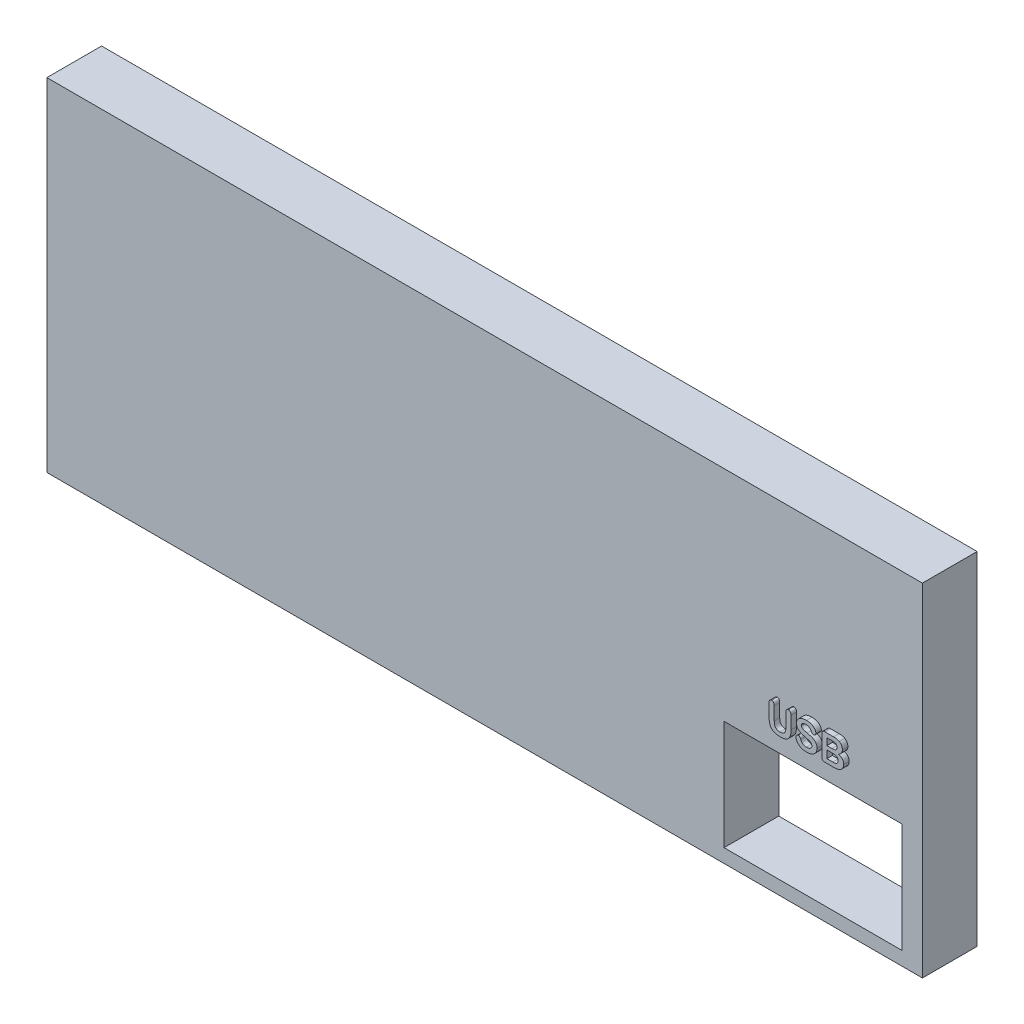
from build123d import *

# Parameters (mm, degrees)
SKETCH1_W           = 64
SKETCH1_H           = 25
BOSS_EXTRUDE1_DEPTH = 4
SKETCH2_W           = 40
SKETCH2_H           = 1
BOSS_EXTRUDE2_DEPTH = 1.5
SKETCH3_W           = 40
SKETCH3_H           = 1
BOSS_EXTRUDE3_DEPTH = 1.5
SKETCH4_W           = 13
SKETCH4_H           = 8.0000094
CUT_EXTRUDE2_DEPTH  = 5.27
BOSS_EXTRUDE5_DEPTH = 0.4


with BuildPart() as part:
    # Sketch1 → Boss-Extrude1 (new body)
    with BuildSketch(Plane.XY):
        with Locations((6.416243655, 2.220812183)):
            Rectangle(SKETCH1_W, SKETCH1_H)
    extrude(amount=BOSS_EXTRUDE1_DEPTH)

    # Sketch2 → Boss-Extrude2 (add)
    with BuildSketch(Plane(origin=(0, 0, 0), x_dir=(-1, 0, 0), z_dir=(0, 0, -1))):
        with Locations((1.583756345, -7.279192817)):
            Rectangle(SKETCH2_W, SKETCH2_H)
    extrude(amount=BOSS_EXTRUDE2_DEPTH)

    # Sketch3 → Boss-Extrude3 (add)
    with BuildSketch(Plane(origin=(0, 0, 0), x_dir=(-1, 0, 0), z_dir=(0, 0, -1))):
        with Locations((1.583756345, -4.279192817)):
            Rectangle(SKETCH3_W, SKETCH3_H)
    extrude(amount=BOSS_EXTRUDE3_DEPTH)

    # Sketch4 → Cut-Extrude2 (cut)
    with BuildSketch(Plane.XY.offset(4)):
        with Locations((30.416243607, -5.279185117)):
            Rectangle(SKETCH4_W, SKETCH4_H)
    extrude(amount=-CUT_EXTRUDE2_DEPTH, mode=Mode.SUBTRACT)

    # Sketch7 → Boss-Extrude5 (add)
    # profile 1 of 3: a face of its own
    with BuildSketch(Plane.XY.offset(4)):
        with BuildLine():
            Line((27.610484396, 1.023759885), (27.610484396, 1.95383801))
            add(Edge.make_bspline(
                [(27.610484396, 1.95383801), (27.61094523, 1.972513796), (27.611809919, 2.007556227), (27.621745355, 2.056457537), (27.637293046, 2.098297902), (27.66016154, 2.132408694), (27.688078487, 2.159053764), (27.720723649, 2.177714437), (27.757054318, 2.189733038), (27.78278238, 2.190792454), (27.796031271, 2.19133801)],
                knots=[0, 0, 0, 0, 1.314006093, 2.465543923, 3.499702682, 4.438645347, 5.334276599, 6.193453487, 7.069703068, 8, 8, 8, 8], degree=3))
            add(Edge.make_bspline(
                [(27.796031271, 2.19133801), (27.809908627, 2.190592789), (27.836569911, 2.189161063), (27.874503998, 2.178001755), (27.907642311, 2.158789299), (27.935950074, 2.131998723), (27.958547381, 2.097558698), (27.974374326, 2.05546074), (27.984070749, 2.006229869), (27.984995252, 1.970944546), (27.985484396, 1.95227551)],
                knots=[0, 0, 0, 0, 0.96282878, 1.849794185, 2.716851436, 3.599658085, 4.532680285, 5.552030856, 6.704809248, 8, 8, 8, 8], degree=3))
            Line((27.985484396, 1.95227551), (27.985484396, 0.994853635))
            add(Edge.make_bspline(
                [(27.985484396, 0.994853635), (27.985928132, 0.968667502), (27.986777425, 0.918548272), (27.993343454, 0.846582342), (28.004436254, 0.781329557), (28.020096873, 0.722386396), (28.042022447, 0.669732636), (28.071171699, 0.623360865), (28.107714858, 0.583363587), (28.143728675, 0.555398746), (28.176156321, 0.536895164), (28.203131959, 0.524740266), (28.232295444, 0.514067716), (28.264069434, 0.506237396), (28.29778462, 0.499361051), (28.333966409, 0.494951534), (28.372398762, 0.491537154), (28.398887335, 0.491405406), (28.412437521, 0.49133801)],
                knots=[0, 0, 0, 0, 1.640841622, 3.140506311, 4.523579023, 5.784571649, 6.954579444, 8.084197464, 9.198982671, 10.333306227, 10.925380769, 11.535182691, 12.185613052, 12.868404783, 13.583722754, 14.340779317, 15.151228418, 16, 16, 16, 16], degree=3))
            add(Edge.make_bspline(
                [(28.412437521, 0.49133801), (28.431077079, 0.491668285), (28.467022542, 0.492305204), (28.518718255, 0.498405435), (28.566360003, 0.507320506), (28.609493911, 0.521176222), (28.648682619, 0.538326273), (28.683575367, 0.559367911), (28.714323666, 0.58439311), (28.740689301, 0.613582343), (28.76294015, 0.647029842), (28.782626402, 0.683856839), (28.798852427, 0.724830461), (28.812582903, 0.76946839), (28.823046365, 0.818221854), (28.830297825, 0.870841321), (28.834568118, 0.927465352), (28.835171825, 0.966460643), (28.835484396, 0.98665051)],
                knots=[0, 0, 0, 0, 1.187087794, 2.289239917, 3.312641325, 4.270309596, 5.169103343, 6.032749862, 6.858132282, 7.686303516, 8.528484611, 9.411791075, 10.342302716, 11.33164497, 12.384483705, 13.515514569, 14.713654137, 16, 16, 16, 16], degree=3))
            Line((28.835484396, 0.98665051), (28.835484396, 1.95227551))
            add(Edge.make_bspline(
                [(28.835484396, 1.95227551), (28.836010283, 1.97119644), (28.8369971, 2.006701219), (28.846094331, 2.056284428), (28.861994751, 2.098178632), (28.884350309, 2.132359639), (28.911996916, 2.159293052), (28.944884511, 2.177594967), (28.981509581, 2.189837062), (29.007513822, 2.190824647), (29.021031271, 2.19133801)],
                knots=[0, 0, 0, 0, 1.324209478, 2.484855026, 3.512713035, 4.440887327, 5.324452051, 6.186293477, 7.057204391, 8, 8, 8, 8], degree=3))
            add(Edge.make_bspline(
                [(29.021031271, 2.19133801), (29.034538733, 2.190791982), (29.060772959, 2.189731485), (29.097865864, 2.177720799), (29.131134202, 2.159190427), (29.159707588, 2.132713238), (29.183306404, 2.098843351), (29.199424976, 2.056683825), (29.209077527, 2.00727214), (29.209996558, 1.971856195), (29.210484396, 1.95305676)],
                knots=[0, 0, 0, 0, 0.937671153, 1.821147261, 2.686184232, 3.571984669, 4.510357278, 5.535961965, 6.692043289, 8, 8, 8, 8], degree=3))
            Line((29.210484396, 1.95305676), (29.210484396, 1.01946301))
            add(Edge.make_bspline(
                [(29.210484396, 1.01946301), (29.209958418, 0.983122147), (29.208948503, 0.913345177), (29.201377484, 0.813367212), (29.188139322, 0.722793953), (29.170246464, 0.640498848), (29.144287357, 0.565027598), (29.108590229, 0.495194134), (29.063726156, 0.429791859), (29.027052362, 0.39126413), (29.008531271, 0.37180676)],
                knots=[0, 0, 0, 0, 1.248457049, 2.397123805, 3.441600438, 4.391152342, 5.286682789, 6.174943873, 7.078305605, 8, 8, 8, 8], degree=3))
            add(Edge.make_bspline(
                [(29.008531271, 0.37180676), (28.990757669, 0.356791201), (28.955252069, 0.32679523), (28.896086129, 0.289522304), (28.833121402, 0.257856632), (28.765491799, 0.232859141), (28.692806372, 0.21414824), (28.614638364, 0.201153438), (28.530718615, 0.192765671), (28.472745062, 0.191823132), (28.442906271, 0.19133801)],
                knots=[0, 0, 0, 0, 0.917673777, 1.83319953, 2.752815171, 3.696261941, 4.673826777, 5.7116717, 6.822205161, 8, 8, 8, 8], degree=3))
            add(Edge.make_bspline(
                [(28.442906271, 0.19133801), (28.407467987, 0.191916181), (28.33907496, 0.193032005), (28.240287217, 0.202156539), (28.1490205, 0.216541524), (28.065330804, 0.237654892), (27.988780973, 0.264616196), (27.92014467, 0.299466461), (27.857883514, 0.339543132), (27.803544183, 0.38742923), (27.756180605, 0.441969916), (27.715500086, 0.503462674), (27.68267007, 0.572465125), (27.65530156, 0.648135936), (27.635668464, 0.731458493), (27.620655217, 0.821996335), (27.612354772, 0.920351154), (27.611122892, 0.988458915), (27.610484396, 1.023759885)],
                knots=[0, 0, 0, 0, 1.244583114, 2.401944964, 3.48169555, 4.486712429, 5.430003149, 6.325898902, 7.184706889, 8.024138875, 8.860562605, 9.715550095, 10.605366032, 11.538500779, 12.536866304, 13.60758979, 14.759988597, 16, 16, 16, 16], degree=3))
        make_face()
    # profile 2 of 3: a face of its own
    with BuildSketch(Plane.XY.offset(4)):
        with BuildLine():
            add(Edge.make_bspline(
                [(31.110484396, 0.815166135), (31.110162636, 0.800442149), (31.109526292, 0.771322608), (31.105111891, 0.728255855), (31.098092466, 0.686367448), (31.088424505, 0.645563154), (31.0754168, 0.606056159), (31.059638968, 0.567612005), (31.041519867, 0.5300475), (31.019725162, 0.494096934), (30.995824224, 0.459454969), (30.968889631, 0.426815446), (30.939778852, 0.395855435), (30.907356322, 0.367319062), (30.872682686, 0.340399629), (30.835402427, 0.315268005), (30.795432953, 0.292236766), (30.752931018, 0.271162788), (30.708004016, 0.252482973), (30.66102891, 0.236151809), (30.61212416, 0.221741803), (30.560920255, 0.211371384), (30.507982454, 0.201953346), (30.452776152, 0.196029901), (30.395574625, 0.19187556), (30.356716331, 0.191518665), (30.337046896, 0.19133801)],
                knots=[0, 0, 0, 0, 0.94904565, 1.876922008, 2.787632434, 3.685409961, 4.577243309, 5.465673456, 6.362823001, 7.262481841, 8.172882791, 9.073480814, 9.987781212, 10.909257821, 11.854472834, 12.815908446, 13.804938933, 14.825933836, 15.871877953, 16.938992789, 18.030809531, 19.155177508, 20.304610591, 21.495671913, 22.732349945, 24, 24, 24, 24], degree=3))
            add(Edge.make_bspline(
                [(30.337046896, 0.19133801), (30.313602923, 0.191779573), (30.267571872, 0.192646559), (30.200089971, 0.197477133), (30.135850476, 0.206707315), (30.074557119, 0.218563771), (30.016441411, 0.234514022), (29.96161887, 0.254278107), (29.909530313, 0.276534676), (29.877249919, 0.295056961), (29.861265646, 0.304228635)],
                knots=[0, 0, 0, 0, 1.136969792, 2.232382444, 3.278022597, 4.282276305, 5.258039159, 6.196692155, 7.1070566, 8, 8, 8, 8], degree=3))
            add(Edge.make_bspline(
                [(29.861265646, 0.304228635), (29.840549639, 0.317891255), (29.799330646, 0.345076003), (29.744641445, 0.395342206), (29.694874269, 0.45084335), (29.652659524, 0.512365261), (29.61808184, 0.576396703), (29.592636925, 0.640811354), (29.576966157, 0.704654875), (29.574817393, 0.747116824), (29.573765646, 0.76790051)],
                knots=[0, 0, 0, 0, 1.048405233, 2.086029851, 3.131870059, 4.19698972, 5.234628962, 6.204463721, 7.121145791, 8, 8, 8, 8], degree=3))
            add(Edge.make_bspline(
                [(29.573765646, 0.76790051), (29.574359615, 0.779550042), (29.575519673, 0.802302307), (29.584829868, 0.834981398), (29.600070588, 0.864843451), (29.620573383, 0.891768383), (29.64626646, 0.913982442), (29.675776047, 0.930308046), (29.708640829, 0.940619369), (29.7317605, 0.94160882), (29.743687521, 0.94211926)],
                knots=[0, 0, 0, 0, 1.029346977, 2.010378973, 2.978887221, 3.98112847, 4.985683985, 5.960201932, 6.947705008, 8, 8, 8, 8], degree=3))
            add(Edge.make_bspline(
                [(29.743687521, 0.94211926), (29.753378325, 0.941742916), (29.772159384, 0.941013548), (29.799120823, 0.933155726), (29.823648749, 0.920524081), (29.845843694, 0.902717993), (29.866316271, 0.88065243), (29.884617559, 0.853434486), (29.901925174, 0.821900046), (29.911139245, 0.79849032), (29.915953146, 0.786259885)],
                knots=[0, 0, 0, 0, 0.932433643, 1.807083439, 2.683354794, 3.577798377, 4.537574086, 5.575745438, 6.73344572, 8, 8, 8, 8], degree=3))
            add(Edge.make_bspline(
                [(29.915953146, 0.786259885), (29.922351811, 0.77149794), (29.934702099, 0.743005389), (29.954433256, 0.702450455), (29.97584207, 0.666246905), (29.997096247, 0.632623734), (30.02179405, 0.602475252), (30.051151746, 0.575953191), (30.084560078, 0.551544027), (30.122737756, 0.529851174), (30.166409302, 0.511932398), (30.216530158, 0.500437885), (30.27232521, 0.49225425), (30.311751853, 0.491652522), (30.332359396, 0.49133801)],
                knots=[0, 0, 0, 0, 1.049400523, 2.025484958, 2.938775158, 3.791458515, 4.617854192, 5.471340711, 6.364831691, 7.311813007, 8.329001391, 9.430967745, 10.65721654, 12, 12, 12, 12], degree=3))
            add(Edge.make_bspline(
                [(30.332359396, 0.49133801), (30.346953576, 0.491514238), (30.375546147, 0.4918595), (30.417275792, 0.495984531), (30.457026663, 0.501982375), (30.494372241, 0.511212176), (30.530022791, 0.521819133), (30.563172847, 0.53616575), (30.594506713, 0.552425759), (30.623389154, 0.571170621), (30.649547872, 0.591829909), (30.672652018, 0.613902839), (30.692021671, 0.637559111), (30.707688519, 0.662433922), (30.72055765, 0.688201808), (30.728885595, 0.715563179), (30.734868681, 0.743942309), (30.735276649, 0.763440394), (30.735484396, 0.77336926)],
                knots=[0, 0, 0, 0, 1.280104897, 2.507951138, 3.676307556, 4.80418709, 5.881088807, 6.935759984, 7.968101261, 8.975871649, 9.951925376, 10.889226907, 11.77430911, 12.626938706, 13.464975202, 14.292430499, 15.130466995, 16, 16, 16, 16], degree=3))
            add(Edge.make_bspline(
                [(30.735484396, 0.77336926), (30.734775183, 0.788683184), (30.733408065, 0.818203124), (30.721744121, 0.860074839), (30.702723053, 0.897528071), (30.675386802, 0.929563406), (30.642627801, 0.95760475), (30.605378773, 0.982325813), (30.563472832, 1.002928794), (30.516793714, 1.020659436), (30.463778387, 1.036328086), (30.403748169, 1.053394729), (30.335328321, 1.069787127), (30.287056357, 1.080836482), (30.261656271, 1.08665051)],
                knots=[0, 0, 0, 0, 0.889216893, 1.714102054, 2.506617733, 3.313297162, 4.145346194, 5.008548814, 5.905982136, 6.85524107, 7.90915739, 9.119934543, 10.484546625, 12, 12, 12, 12], degree=3))
            add(Edge.make_bspline(
                [(30.261656271, 1.08665051), (30.228376951, 1.094824625), (30.164330639, 1.110555774), (30.073185974, 1.137880591), (29.990539588, 1.167220018), (29.915431859, 1.198031844), (29.848247401, 1.23365242), (29.788405138, 1.274892455), (29.736323915, 1.322474391), (29.698435609, 1.36664401), (29.672980848, 1.40520706), (29.655967471, 1.435770071), (29.641969183, 1.468260001), (29.63068929, 1.502424383), (29.621715443, 1.538069971), (29.614997827, 1.575373312), (29.611054171, 1.614428918), (29.610676503, 1.6410686), (29.610484396, 1.65461926)],
                knots=[0, 0, 0, 0, 1.736501148, 3.341910126, 4.819600125, 6.179978285, 7.452384316, 8.666026066, 9.852526874, 11.018500134, 11.604160195, 12.191898388, 12.788898658, 13.394048862, 14.013423104, 14.650267458, 15.313438986, 16, 16, 16, 16], degree=3))
            add(Edge.make_bspline(
                [(29.610484396, 1.65461926), (29.61062389, 1.667656362), (29.610899498, 1.693414783), (29.615686623, 1.731465992), (29.621841353, 1.768562817), (29.632054214, 1.804314391), (29.643977455, 1.839145201), (29.658815133, 1.872969526), (29.677014525, 1.905249411), (29.697171078, 1.936685374), (29.720384948, 1.966299553), (29.745835678, 1.994629396), (29.773940922, 2.021131347), (29.804477328, 2.045653514), (29.837087774, 2.068603662), (29.872480453, 2.08925834), (29.910284354, 2.108194606), (29.964223066, 2.132214605), (30.037358571, 2.156115035), (30.131273004, 2.176880786), (30.23257275, 2.188846141), (30.302510198, 2.190489677), (30.338609396, 2.19133801)],
                knots=[0, 0, 0, 0, 0.769447055, 1.520256708, 2.262508943, 2.988321943, 3.713156319, 4.436274914, 5.166110871, 5.89994773, 6.639925254, 7.385953261, 8.147635144, 8.918771606, 9.697541001, 10.500837489, 11.336648996, 12.194084557, 13.986552036, 15.869357873, 17.867910982, 20, 20, 20, 20], degree=3))
            add(Edge.make_bspline(
                [(30.338609396, 2.19133801), (30.367406719, 2.190854856), (30.423042821, 2.189921406), (30.503494669, 2.181600726), (30.577903263, 2.168217485), (30.646287079, 2.149104647), (30.708488141, 2.12477818), (30.766016732, 2.098415811), (30.817257455, 2.06680291), (30.863087506, 2.032450235), (30.90312827, 1.995954645), (30.937506762, 1.958136651), (30.96629473, 1.919528647), (30.988884575, 1.879838667), (31.006667845, 1.840345872), (31.019267022, 1.801054937), (31.027137628, 1.762097233), (31.028018511, 1.73616463), (31.028453146, 1.72336926)],
                knots=[0, 0, 0, 0, 1.501690988, 2.90125006, 4.213360721, 5.441058994, 6.597662568, 7.694391675, 8.736870916, 9.731158549, 10.678212085, 11.558107852, 12.393499291, 13.184506524, 13.935459515, 14.648542639, 15.3331793, 16, 16, 16, 16], degree=3))
            add(Edge.make_bspline(
                [(31.028453146, 1.72336926), (31.027842644, 1.71198079), (31.026637032, 1.689490948), (31.017227975, 1.656696403), (31.001701607, 1.625966164), (30.980801159, 1.597742812), (30.955561225, 1.573553), (30.926225178, 1.555902566), (30.893819186, 1.544742839), (30.870991979, 1.543524083), (30.859312521, 1.54290051)],
                knots=[0, 0, 0, 0, 0.996822281, 1.968514991, 2.963507279, 3.999520829, 5.032703306, 6.005199511, 6.979367534, 8, 8, 8, 8], degree=3))
            add(Edge.make_bspline(
                [(30.859312521, 1.54290051), (30.848997462, 1.543256077), (30.829507827, 1.543927898), (30.802202392, 1.549388498), (30.778611517, 1.558221474), (30.758431999, 1.571516284), (30.740543995, 1.589209465), (30.722781312, 1.611050352), (30.703415876, 1.636692334), (30.691439701, 1.65607012), (30.685093771, 1.66633801)],
                knots=[0, 0, 0, 0, 1.091449335, 2.062222683, 2.935356023, 3.742291246, 4.60049062, 5.589116983, 6.722522559, 8, 8, 8, 8], degree=3))
            add(Edge.make_bspline(
                [(30.685093771, 1.66633801), (30.675939776, 1.685144039), (30.658276268, 1.721432068), (30.626928634, 1.771107976), (30.59228642, 1.813804218), (30.561293931, 1.845187959), (30.533959901, 1.866786644), (30.510108327, 1.879966875), (30.483592128, 1.891102707), (30.454391008, 1.90070021), (30.422148194, 1.907494351), (30.387043348, 1.912492737), (30.349081804, 1.915636095), (30.322860363, 1.916098895), (30.309312521, 1.91633801)],
                knots=[0, 0, 0, 0, 1.547925219, 2.986869477, 4.337480217, 5.612327564, 6.244828973, 6.909713596, 7.622436063, 8.372459485, 9.181850378, 10.058552105, 10.996911345, 12, 12, 12, 12], degree=3))
            add(Edge.make_bspline(
                [(30.309312521, 1.91633801), (30.28439651, 1.915511849), (30.236847404, 1.913935223), (30.169018617, 1.902113779), (30.108910174, 1.880888727), (30.064792009, 1.856401543), (30.034005745, 1.833902779), (30.014602055, 1.815862941), (29.997717645, 1.797448019), (29.984449037, 1.777700436), (29.973824172, 1.757267778), (29.965659698, 1.736004177), (29.961529304, 1.713633038), (29.96083287, 1.698513003), (29.960484396, 1.690947385)],
                knots=[0, 0, 0, 0, 1.954508865, 3.729936959, 5.377867423, 6.932763574, 7.670377485, 8.364471239, 9.008409927, 9.626125187, 10.224705099, 10.812996495, 11.406058616, 12, 12, 12, 12], degree=3))
            add(Edge.make_bspline(
                [(29.960484396, 1.690947385), (29.96081565, 1.681666084), (29.96146749, 1.663402341), (29.967901596, 1.637116735), (29.978292159, 1.612766207), (29.992469344, 1.59028927), (30.010637001, 1.569962945), (30.032241284, 1.551743188), (30.055837146, 1.53381997), (30.0921569, 1.513541826), (30.139484496, 1.491383237), (30.190185628, 1.473791449), (30.235934982, 1.461513112), (30.279630491, 1.45034527), (30.332637465, 1.436461546), (30.37127217, 1.427197564), (30.392125021, 1.422197385)],
                knots=[0, 0, 0, 0, 0.710476229, 1.398074961, 2.059979244, 2.732930957, 3.425942516, 4.140543967, 4.897202213, 5.693324271, 7.323324828, 8.898613798, 9.799484583, 10.954336094, 12.356121149, 14, 14, 14, 14], degree=3))
            add(Edge.make_bspline(
                [(30.392125021, 1.422197385), (30.418716791, 1.415803579), (30.470736849, 1.403295718), (30.546698022, 1.38294501), (30.618796425, 1.361648717), (30.686955607, 1.33892075), (30.750913819, 1.315267122), (30.809822335, 1.288473481), (30.863934358, 1.259736446), (30.91326176, 1.228118419), (30.957364911, 1.192629231), (30.996997989, 1.153558025), (31.030636985, 1.109298372), (31.05940335, 1.060907163), (31.08295889, 1.007591768), (31.099073136, 0.948371271), (31.10895032, 0.883598888), (31.109961067, 0.838511039), (31.110484396, 0.815166135)],
                knots=[0, 0, 0, 0, 1.267502217, 2.479546844, 3.644246111, 4.751070339, 5.809111578, 6.802976886, 7.747931384, 8.64678748, 9.513844361, 10.367269951, 11.219414442, 12.082556445, 12.971635876, 13.911644553, 14.918722911, 16, 16, 16, 16], degree=3))
        make_face()
    # profile 3 of 3: a face of its own
    with BuildSketch(Plane.XY.offset(4)):
        with BuildLine():
            Line((32.283140646, 0.21633801), (31.696421896, 0.21633801))
            add(Edge.make_bspline(
                [(31.696421896, 0.21633801), (31.68612901, 0.216443116), (31.666414054, 0.216644435), (31.63793618, 0.219414355), (31.611835214, 0.224086434), (31.58789398, 0.230265413), (31.566121332, 0.238098164), (31.546508286, 0.247634444), (31.529556893, 0.259703079), (31.509234213, 0.277551159), (31.488717083, 0.306624531), (31.472276084, 0.349118709), (31.462191874, 0.399599182), (31.461079659, 0.435946997), (31.460484396, 0.45540051)],
                knots=[0, 0, 0, 0, 0.950729654, 1.821024047, 2.639907261, 3.398604693, 4.102683231, 4.775219685, 5.406000082, 6.019447712, 7.268382492, 8.644570224, 10.204158913, 12, 12, 12, 12], degree=3))
            Line((31.460484396, 0.45540051), (31.460484396, 1.90227551))
            add(Edge.make_bspline(
                [(31.460484396, 1.90227551), (31.461025924, 1.922128362), (31.462032695, 1.959037419), (31.472633699, 2.010018741), (31.489382517, 2.052636426), (31.514566933, 2.086963762), (31.54850679, 2.112270261), (31.59071355, 2.129281529), (31.640841798, 2.139693433), (31.677094183, 2.140766116), (31.696421896, 2.14133801)],
                knots=[0, 0, 0, 0, 1.222174323, 2.272182497, 3.193385757, 4.024939207, 4.86132091, 5.767718531, 6.809874283, 8, 8, 8, 8], degree=3))
            Line((31.696421896, 2.14133801), (32.318296896, 2.14133801))
            add(Edge.make_bspline(
                [(32.318296896, 2.14133801), (32.340435193, 2.141087093), (32.383302275, 2.140601235), (32.445219646, 2.137627396), (32.502571107, 2.132151604), (32.555748862, 2.124590954), (32.605384875, 2.113566655), (32.65232616, 2.099403992), (32.696246339, 2.080025601), (32.723760677, 2.064359634), (32.737437521, 2.056572385)],
                knots=[0, 0, 0, 0, 1.226361742, 2.374642816, 3.432537546, 4.416889029, 5.347867328, 6.246718495, 7.128477734, 8, 8, 8, 8], degree=3))
            add(Edge.make_bspline(
                [(32.737437521, 2.056572385), (32.748763992, 2.049470169), (32.771415859, 2.03526641), (32.80307689, 2.010553341), (32.832493801, 1.98287184), (32.860073203, 1.953106848), (32.885153113, 1.921047978), (32.907108284, 1.887110333), (32.925406959, 1.851222982), (32.941129192, 1.81408204), (32.953766578, 1.775594845), (32.962101661, 1.735747173), (32.968036753, 1.695032086), (32.968469146, 1.667401772), (32.968687521, 1.653447385)],
                knots=[0, 0, 0, 0, 0.989179716, 1.978265507, 2.967116444, 3.97665542, 4.979268596, 5.976539418, 6.963744816, 7.957282277, 8.960127083, 9.956465876, 10.967935579, 12, 12, 12, 12], degree=3))
            add(Edge.make_bspline(
                [(32.968687521, 1.653447385), (32.967821505, 1.629936678), (32.966136382, 1.584188715), (32.952015692, 1.51809593), (32.929371461, 1.456661585), (32.896866811, 1.400292145), (32.855300183, 1.348786629), (32.804038687, 1.303028903), (32.744239423, 1.261556837), (32.699601923, 1.239224248), (32.676500021, 1.227666135)],
                knots=[0, 0, 0, 0, 1.026786861, 1.997958018, 2.939919024, 3.878158348, 4.829291737, 5.820536811, 6.872030375, 8, 8, 8, 8], degree=3))
            add(Edge.make_bspline(
                [(32.676500021, 1.227666135), (32.692059895, 1.2225067), (32.72242675, 1.21243748), (32.765914298, 1.194651254), (32.806656561, 1.175712379), (32.844315355, 1.154623601), (32.878729897, 1.131379655), (32.910614504, 1.106913534), (32.939128706, 1.080248619), (32.96477895, 1.051916903), (32.98741419, 1.021864127), (33.007210015, 0.990039327), (33.023406905, 0.956250493), (33.037506351, 0.921038119), (33.047208791, 0.883537341), (33.055392865, 0.844637733), (33.05947145, 0.80379402), (33.060143069, 0.776110379), (33.060484396, 0.762041135)],
                knots=[0, 0, 0, 0, 1.203679095, 2.349115882, 3.448557464, 4.501905559, 5.515114208, 6.496455107, 7.450530545, 8.378166232, 9.30006595, 10.210385309, 11.125664208, 12.049149821, 12.991069707, 13.966334133, 14.966460368, 16, 16, 16, 16], degree=3))
            add(Edge.make_bspline(
                [(33.060484396, 0.762041135), (33.059608769, 0.736040064), (33.057879692, 0.68469645), (33.041114148, 0.609990481), (33.014890959, 0.539080263), (32.978007947, 0.473373797), (32.93287312, 0.413458563), (32.879615162, 0.361391405), (32.818812088, 0.317536263), (32.773624529, 0.296003205), (32.750718771, 0.28508801)],
                knots=[0, 0, 0, 0, 1.034007292, 2.041826266, 3.032819392, 4.03550363, 5.031030359, 6.010000582, 6.991261149, 8, 8, 8, 8], degree=3))
            add(Edge.make_bspline(
                [(32.750718771, 0.28508801), (32.735566228, 0.279004352), (32.704621356, 0.266580165), (32.655626812, 0.251839926), (32.603336521, 0.240335217), (32.547697795, 0.230803343), (32.488056518, 0.224449451), (32.423950501, 0.219890762), (32.355180819, 0.216535647), (32.307624143, 0.216405179), (32.283140646, 0.21633801)],
                knots=[0, 0, 0, 0, 0.823393962, 1.68155411, 2.577109222, 3.523060306, 4.5276929, 5.601251204, 6.765057529, 8, 8, 8, 8], degree=3))
        make_face()
        with BuildLine():
            Line((32.246812521, 1.06633801), (31.835484396, 1.06633801))
            Line((31.835484396, 1.06633801), (31.835484396, 0.51633801))
            Line((31.835484396, 0.51633801), (32.260093771, 0.51633801))
            add(Edge.make_bspline(
                [(32.260093771, 0.51633801), (32.27624435, 0.516584656), (32.307534992, 0.517062516), (32.352928156, 0.520113019), (32.395222066, 0.525463582), (32.434465152, 0.533365061), (32.470659816, 0.54297943), (32.50394157, 0.554520025), (32.533639843, 0.569132309), (32.560395341, 0.58552364), (32.58418816, 0.603938821), (32.604530561, 0.624810326), (32.62217078, 0.647726824), (32.635958952, 0.673170687), (32.647261441, 0.700609046), (32.654825667, 0.730329859), (32.659656276, 0.762143506), (32.660203783, 0.784027894), (32.660484396, 0.79524426)],
                knots=[0, 0, 0, 0, 1.397840841, 2.708221037, 3.935522691, 5.08480215, 6.170083952, 7.175292938, 8.127891873, 9.028615238, 9.887548979, 10.724312948, 11.544753106, 12.382123976, 13.221312913, 14.106963916, 15.029765574, 16, 16, 16, 16], degree=3))
            add(Edge.make_bspline(
                [(32.660484396, 0.79524426), (32.660249724, 0.806726479), (32.659793879, 0.829030488), (32.654422592, 0.861058977), (32.646771085, 0.890926702), (32.635496875, 0.918368344), (32.620528115, 0.943209543), (32.602127268, 0.965312691), (32.581109876, 0.985445917), (32.556368554, 1.002565066), (32.528900017, 1.01807562), (32.49773141, 1.030574609), (32.463806572, 1.042138523), (32.426480928, 1.050878369), (32.386177129, 1.057864372), (32.34263216, 1.063015296), (32.295799439, 1.065488353), (32.263481338, 1.066048897), (32.246812521, 1.06633801)],
                knots=[0, 0, 0, 0, 0.978374407, 1.900475129, 2.762565409, 3.604092296, 4.421226212, 5.226116304, 6.051062672, 6.895443069, 7.785413459, 8.736294548, 9.754820785, 10.840413303, 12.001711888, 13.242950972, 14.577987407, 16, 16, 16, 16], degree=3))
        make_face(mode=Mode.SUBTRACT)
        with BuildLine():
            Line((31.835484396, 1.84133801), (31.835484396, 1.34133801))
            Line((31.835484396, 1.34133801), (32.197593771, 1.34133801))
            add(Edge.make_bspline(
                [(32.197593771, 1.34133801), (32.220784349, 1.341520399), (32.264505518, 1.341864256), (32.325840034, 1.347427652), (32.378944508, 1.355688884), (32.42469888, 1.367363009), (32.463849309, 1.385005823), (32.49788292, 1.408276413), (32.526448377, 1.438694162), (32.541214817, 1.462412664), (32.548765646, 1.474541135)],
                knots=[0, 0, 0, 0, 1.403565858, 2.64614101, 3.724413317, 4.655733905, 5.495397674, 6.311071983, 7.136365515, 8, 8, 8, 8], degree=3))
            add(Edge.make_bspline(
                [(32.548765646, 1.474541135), (32.554034127, 1.483902228), (32.564586624, 1.502652015), (32.574642198, 1.533421324), (32.581944813, 1.565474032), (32.582478061, 1.587517544), (32.582750021, 1.598759885)],
                knots=[0, 0, 0, 0, 0.986348614, 1.975605531, 2.967545036, 4, 4, 4, 4], degree=3))
            add(Edge.make_bspline(
                [(32.582750021, 1.598759885), (32.582524325, 1.610501489), (32.582093105, 1.632935216), (32.576792577, 1.665032338), (32.568740878, 1.694074513), (32.55746812, 1.720317303), (32.542295499, 1.743335339), (32.523959525, 1.763439782), (32.501917547, 1.779973343), (32.476899528, 1.793800209), (32.448510452, 1.804855384), (32.416888864, 1.814614582), (32.381979987, 1.823265114), (32.343404827, 1.829558897), (32.301631345, 1.835311348), (32.256350133, 1.838388791), (32.207649665, 1.840985451), (32.174030424, 1.841217533), (32.156578146, 1.84133801)],
                knots=[0, 0, 0, 0, 1.003025396, 1.916398969, 2.77282862, 3.575462095, 4.347472474, 5.119643405, 5.89012688, 6.692528659, 7.556738954, 8.489916057, 9.521455324, 10.628856332, 11.830320039, 13.125714765, 14.507913242, 16, 16, 16, 16], degree=3))
            Line((32.156578146, 1.84133801), (31.835484396, 1.84133801))
        make_face(mode=Mode.SUBTRACT)
    extrude(amount=BOSS_EXTRUDE5_DEPTH)


solid = part.part
